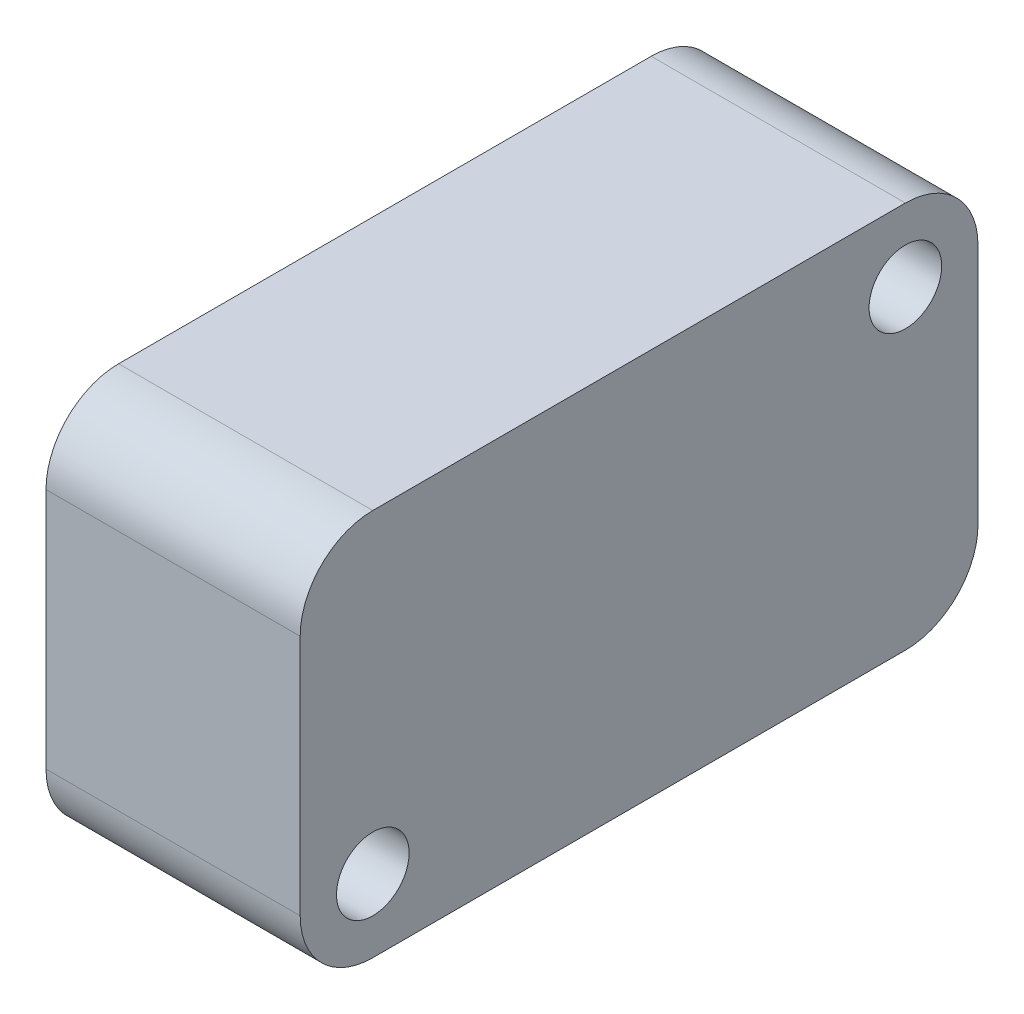
from build123d import *

# Parameters (mm, degrees)
SKETCH1_W           = 28
SKETCH1_H           = 16
BOSS_EXTRUDE1_DEPTH = 10.5
SKETCH2_R           = 1.5
CUT_EXTRUDE1_DEPTH  = 20.241881405
FILLET1_R           = 3
SKETCH3_W           = 4.5
SKETCH3_H           = 2.5
BOSS_EXTRUDE2_DEPTH = 2.5
FILLET2_R           = 0.5


with BuildPart() as part:
    # Sketch1 → Boss-Extrude1 (new body)
    with BuildSketch(Plane(origin=(0, 0, 0), x_dir=(0, 0, -1), z_dir=(1, 0, 0))):
        Rectangle(SKETCH1_W, SKETCH1_H)
    extrude(amount=BOSS_EXTRUDE1_DEPTH)

    # Sketch2 → Cut-Extrude1 (cut, through all)
    with BuildSketch(Plane(origin=(10.5, 0, 0), x_dir=(0, 0, -1), z_dir=(1, 0, 0))):
        with Locations((11, 5)):
            Circle(SKETCH2_R)
        with Locations((-11, -5)):
            Circle(SKETCH2_R)
    extrude(amount=-CUT_EXTRUDE1_DEPTH, mode=Mode.SUBTRACT)

    # Fillet1
    fillet1_edges = [part.edges().sort_by_distance(p)[0] for p in [
        (5.25, -8, -14),
        (5.25, -8, 14),
        (5.25, 8, 14),
        (5.25, 8, -14),
    ]]
    fillet(fillet1_edges, radius=FILLET1_R)

    # Sketch3 → Boss-Extrude2 (add)
    with BuildSketch(Plane.XZ.offset(8)):
        with Locations((5.25, -9.25)):
            Rectangle(SKETCH3_W, SKETCH3_H)
    extrude(amount=BOSS_EXTRUDE2_DEPTH)

    # Fillet2
    fillet2_edges = [part.edges().sort_by_distance(p)[0] for p in [
        (5.25, -10.5, -10.5),
        (5.25, -10.5, -8),
    ]]
    fillet(fillet2_edges, radius=FILLET2_R)


solid = part.part
